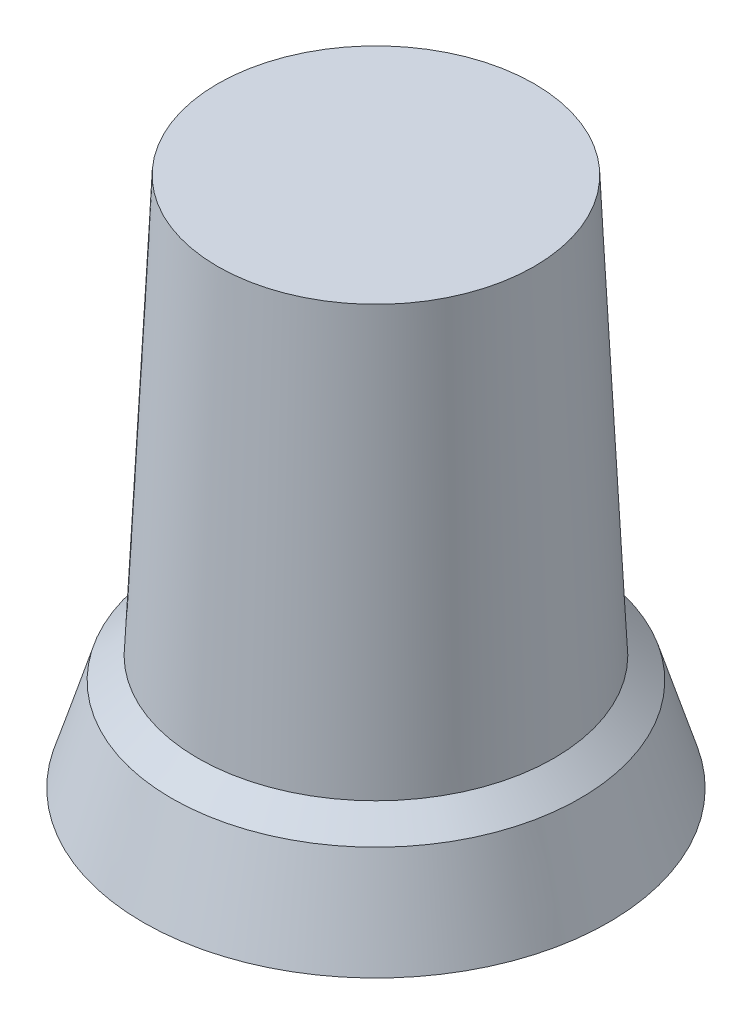
from build123d import *


with BuildPart() as part:
    # Schizzo1 → Rivoluzione1 (revolve)
    with BuildSketch(Plane.XY, mode=Mode.PRIVATE) as rivoluzione1_sk:
        Polygon((6.830726988, -8.387277259), (5.972508756, -5.587032245), (5.05357518, -4.82347792), (4.432541097, 8.217841328), (0, 8.217841328), (0, 8.917841328), (5.1, 8.917841328), (5.738114638, -4.482158672), (6.580560922, -5.182158672), (7.5, -8.182158672), align=None)
    revolve(rivoluzione1_sk.sketch.rotate(Axis((0, 55, 0), (0, -1, 0)), 90), axis=Axis((0, 55, 0), (0, -1, 0)))


solid = part.part
